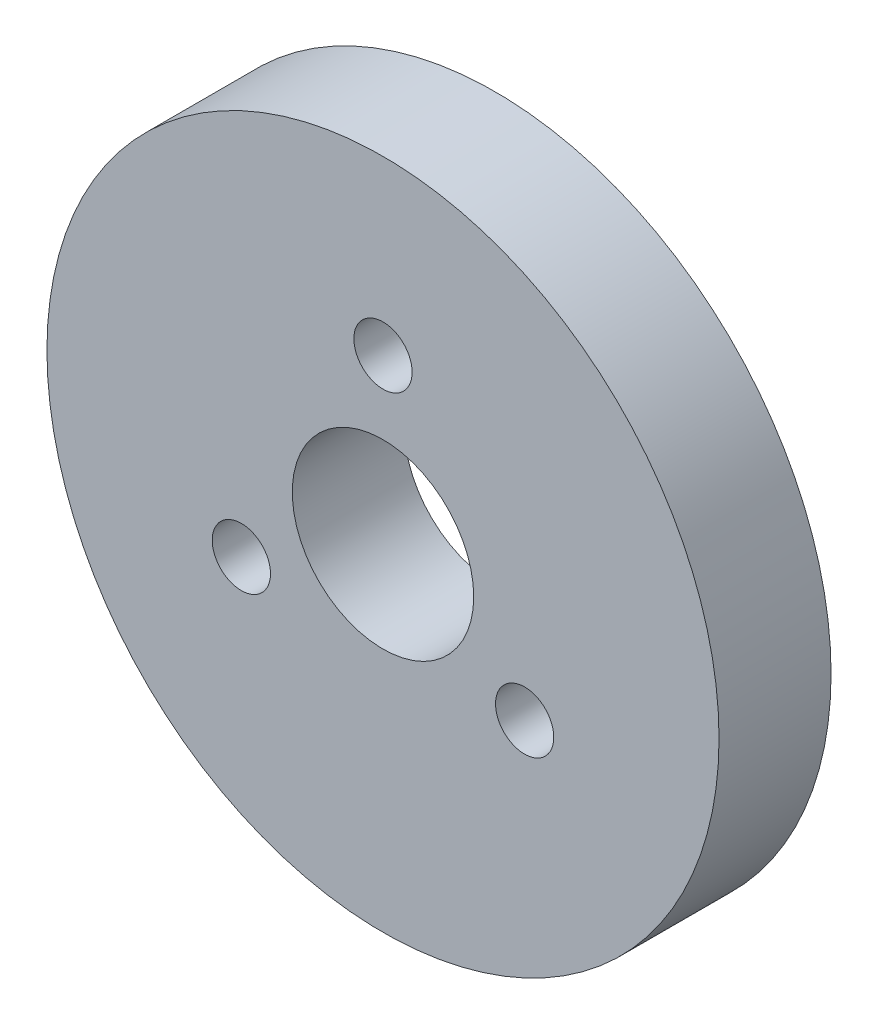
from build123d import *

# Parameters (mm, degrees)
SKETCH1_R           = 15
SKETCH1_R_2         = 4.05
SKETCH1_R_3         = 1.3
BOSS_EXTRUDE1_DEPTH = 5


with BuildPart() as part:
    # Sketch1 → Boss-Extrude1 (new body)
    with BuildSketch(Plane.XY):
        Circle(SKETCH1_R)
        Circle(SKETCH1_R_2, mode=Mode.SUBTRACT)
        with Locations((0, 7.3)):
            Circle(SKETCH1_R_3, mode=Mode.SUBTRACT)
        with Locations((6.321985448, -3.65)):
            Circle(SKETCH1_R_3, mode=Mode.SUBTRACT)
        with Locations((-6.321985448, -3.65)):
            Circle(SKETCH1_R_3, mode=Mode.SUBTRACT)
    extrude(amount=BOSS_EXTRUDE1_DEPTH)


solid = part.part
